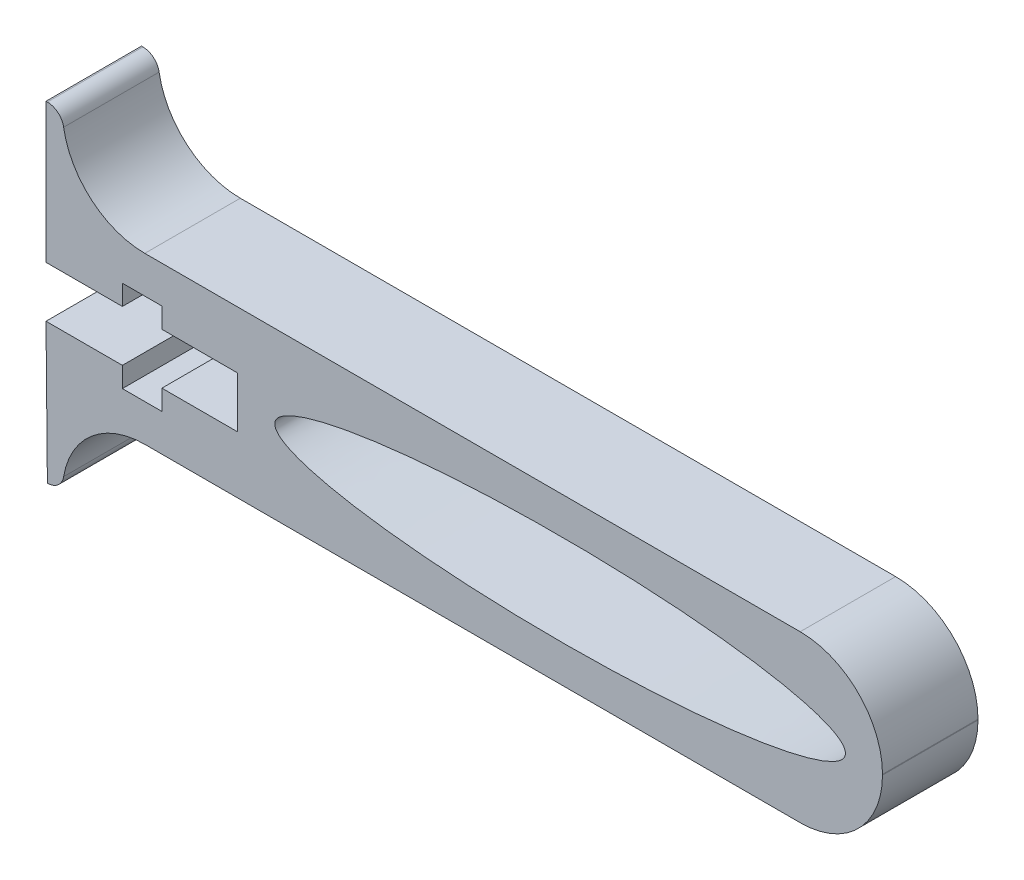
from build123d import *

# Parameters (mm, degrees)
SKETCH1_RX          = 17.328454948
SKETCH1_RY          = 2.772242018
BOSS_EXTRUDE1_DEPTH = 5.8


with BuildPart() as part:
    # Sketch1 → Boss-Extrude1 (new body)
    with BuildSketch(Plane.XY):
        with BuildLine():
            Line((-10.059850626, 29.356682147), (-12.459850626, 29.356682147))
            Line((-12.459850626, 29.356682147), (-12.459850626, 28.132280135))
            Line((-12.459850626, 28.132280135), (-17.098055654, 28.132280135))
            Line((-17.098055654, 28.132280135), (-17.098055654, 36.606682147))
            Line((-17.098055654, 36.606682147), (-17.014135437, 36.606682147))
            ThreePointArc((-17.014135437, 36.606682147), (-16.368638213, 36.370444763), (-16.02812214, 35.773348814))
            ThreePointArc((-16.02812214, 35.773348814), (-14.325541776, 32.787869068), (-11.098055654, 31.606682147))
            Line((-11.098055654, 31.606682147), (28.701944346, 31.606682147))
            ThreePointArc((28.701944346, 31.606682147), (32.237478252, 30.142216053), (33.701944346, 26.606682147))
            Line((33.701944346, 26.606682147), (33.701944346, 26.562198111))
            ThreePointArc((33.701944346, 26.562198111), (32.237478252, 23.026664205), (28.701944346, 21.562198111))
            Line((28.701944346, 21.562198111), (-11.098055654, 21.562198111))
            ThreePointArc((-11.098055654, 21.562198111), (-14.325541776, 20.38101119), (-16.02812214, 17.395531445))
            ThreePointArc((-16.02812214, 17.395531445), (-16.368638213, 16.798435495), (-17.014135437, 16.562198111))
            Line((-17.014135437, 16.562198111), (-17.098055654, 25.036600123))
            Line((-17.098055654, 25.036600123), (-12.459850626, 25.036600123))
            Line((-12.459850626, 25.036600123), (-12.459850626, 23.812198111))
            Line((-12.459850626, 23.812198111), (-10.059850626, 23.812198111))
            Line((-10.059850626, 23.812198111), (-10.059850626, 25.036600123))
            Line((-10.059850626, 25.036600123), (-5.45496555, 25.036600123))
            Line((-5.45496555, 25.036600123), (-5.45496555, 28.132280135))
            Line((-5.45496555, 28.132280135), (-10.059850626, 28.132280135))
            Line((-10.059850626, 28.132280135), (-10.059850626, 29.356682147))
        make_face()
        with Locations(Location((14.123489398, 26.584440129), (0, 0, -180))):
            Ellipse(SKETCH1_RX, SKETCH1_RY, mode=Mode.SUBTRACT)
    extrude(amount=BOSS_EXTRUDE1_DEPTH)


solid = part.part
